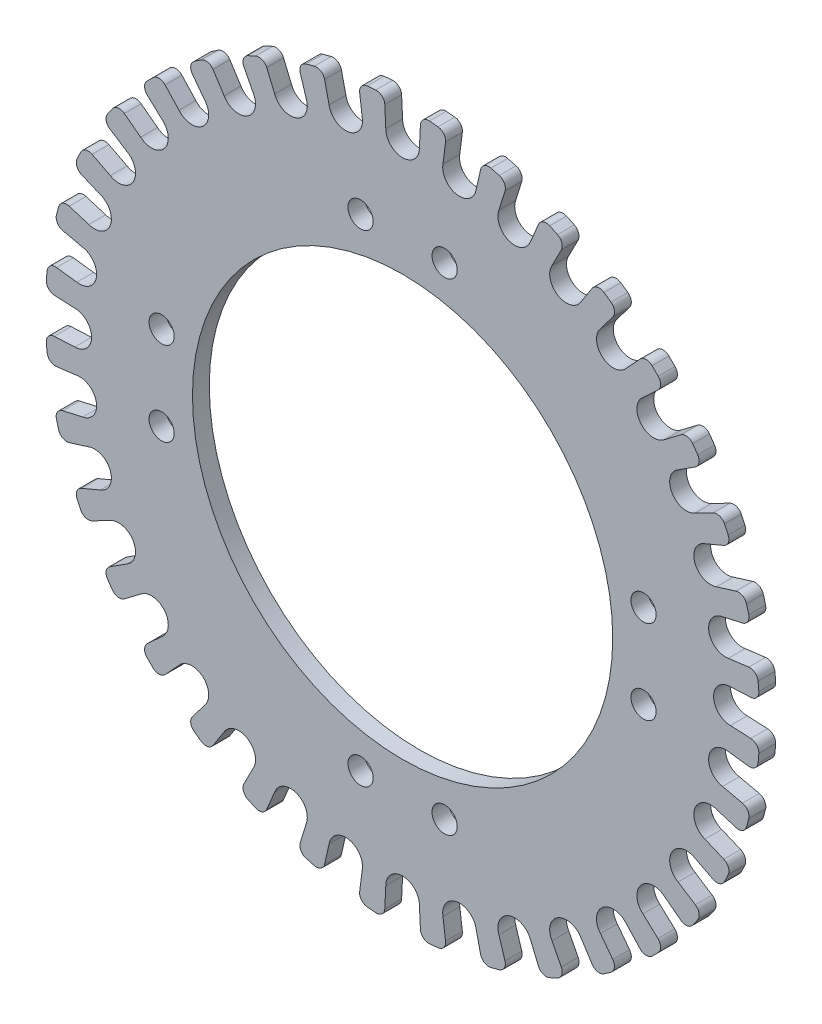
from build123d import *

# Parameters (mm, degrees)
SKETCH1_R                = 42.5
SKETCH1_R_2              = 25
SKETCH1_R_3              = 1.5
BOSS_EXTRUDE1_DEPTH      = 2
CUT_EXTRUDE1_DEPTH       = 61.137342808
FILLET1_R                = 1
CIRPATTERN1_COUNT        = 36
FILLET1_OF_CIRPATTERN1_R = 1


with BuildPart() as part:
    # Sketch1 → Boss-Extrude1 (new body)
    with BuildSketch(Plane.XY):
        Circle(SKETCH1_R)
        Circle(SKETCH1_R_2, mode=Mode.SUBTRACT)
        with Locations((-5, 28.665374196)):
            Circle(SKETCH1_R_3, mode=Mode.SUBTRACT)
        with Locations(Location((5, 28.665374196, 0), (0, 0, 180))):
            Circle(SKETCH1_R_3, mode=Mode.SUBTRACT)
        with Locations((28.665374196, 5)):
            Circle(SKETCH1_R_3, mode=Mode.SUBTRACT)
        with Locations(Location((28.665374196, -5, 0), (0, 0, 180))):
            Circle(SKETCH1_R_3, mode=Mode.SUBTRACT)
        with Locations((5, -28.665374196)):
            Circle(SKETCH1_R_3, mode=Mode.SUBTRACT)
        with Locations(Location((-5, -28.665374196, 0), (0, 0, 180))):
            Circle(SKETCH1_R_3, mode=Mode.SUBTRACT)
        with Locations((-28.665374196, -5)):
            Circle(SKETCH1_R_3, mode=Mode.SUBTRACT)
        with Locations(Location((-28.665374196, 5, 0), (0, 0, 180))):
            Circle(SKETCH1_R_3, mode=Mode.SUBTRACT)
    extrude(amount=BOSS_EXTRUDE1_DEPTH)

    # Sketch2 → Cut-Extrude1 (cut, through all)
    with BuildSketch(Plane.XY.offset(2)):
        with BuildLine():
            Line((-2, 39), (-2.25, 44.151660968))
            Line((-2.25, 44.151660968), (2.25, 44.151660968))
            Line((2.25, 44.151660968), (2, 39))
            ThreePointArc((2, 39), (0, 37), (-2, 39))
        make_face()
    cut_extrude1 = extrude(amount=-CUT_EXTRUDE1_DEPTH, mode=Mode.SUBTRACT)

    # Fillet1
    fillet1_edges = [part.edges().sort_by_distance(p)[0] for p in [
        (2.167165012, 42.444709868, 1),
        (-2.167165012, 42.444709868, 1),
    ]]
    fillet(fillet1_edges, radius=FILLET1_R)

    # CirPattern1: Cut-Extrude1 ×36 about axis
    cirpattern1_axis = Axis((0, 0, 0), (0, 0, 1))
    for i in range(1, CIRPATTERN1_COUNT):
        add(cut_extrude1.rotate(cirpattern1_axis, i * 360 / CIRPATTERN1_COUNT), mode=Mode.SUBTRACT)

    # Fillet1 of CirPattern1
    fillet1_of_cirpattern1_edges = [part.edges().sort_by_distance(p)[0] for p in [
        (-5.236205614, 42.176203608, 1),
        (-9.504687426, 41.423555098, 1),
        (-12.480476783, 40.626194743, 1),
        (-16.553414722, 39.143766567, 1),
        (-19.34553498, 37.841779508, 1),
        (-23.099174889, 35.674614496, 1),
        (-25.622788885, 33.907560952, 1),
        (-28.943078315, 31.121507317, 1),
        (-31.121507317, 28.943078315, 1),
        (-33.907560952, 25.622788885, 1),
        (-35.674614496, 23.099174889, 1),
        (-37.841779508, 19.34553498, 1),
        (-39.143766567, 16.553414722, 1),
        (-40.626194743, 12.480476783, 1),
        (-41.423555098, 9.504687426, 1),
        (-42.176203608, 5.236205614, 1),
        (-42.444709868, 2.167165012, 1),
        (-42.444709868, -2.167165012, 1),
        (-42.176203608, -5.236205614, 1),
        (-41.423555098, -9.504687426, 1),
        (-40.626194743, -12.480476783, 1),
        (-39.143766567, -16.553414722, 1),
        (-37.841779508, -19.34553498, 1),
        (-35.674614496, -23.099174889, 1),
        (-33.907560952, -25.622788885, 1),
        (-31.121507317, -28.943078315, 1),
        (-28.943078315, -31.121507317, 1),
        (-25.622788885, -33.907560952, 1),
        (-23.099174889, -35.674614496, 1),
        (-19.34553498, -37.841779508, 1),
        (-16.553414722, -39.143766567, 1),
        (-12.480476783, -40.626194743, 1),
        (-9.504687426, -41.423555098, 1),
        (-5.236205614, -42.176203608, 1),
        (-2.167165012, -42.444709868, 1),
        (2.167165012, -42.444709868, 1),
        (5.236205614, -42.176203608, 1),
        (9.504687426, -41.423555098, 1),
        (12.480476783, -40.626194743, 1),
        (16.553414722, -39.143766567, 1),
        (19.34553498, -37.841779508, 1),
        (23.099174889, -35.674614496, 1),
        (25.622788885, -33.907560952, 1),
        (28.943078315, -31.121507317, 1),
        (31.121507317, -28.943078315, 1),
        (33.907560952, -25.622788885, 1),
        (35.674614496, -23.099174889, 1),
        (37.841779508, -19.34553498, 1),
        (39.143766567, -16.553414722, 1),
        (40.626194743, -12.480476783, 1),
        (41.423555098, -9.504687426, 1),
        (42.176203608, -5.236205614, 1),
        (42.444709868, -2.167165012, 1),
        (42.444709868, 2.167165012, 1),
        (42.176203608, 5.236205614, 1),
        (41.423555098, 9.504687426, 1),
        (40.626194743, 12.480476783, 1),
        (39.143766567, 16.553414722, 1),
        (37.841779508, 19.34553498, 1),
        (35.674614496, 23.099174889, 1),
        (33.907560952, 25.622788885, 1),
        (31.121507317, 28.943078315, 1),
        (28.943078315, 31.121507317, 1),
        (25.622788885, 33.907560952, 1),
        (23.099174889, 35.674614496, 1),
        (19.34553498, 37.841779508, 1),
        (16.553414722, 39.143766567, 1),
        (12.480476783, 40.626194743, 1),
        (9.504687426, 41.423555098, 1),
        (5.236205614, 42.176203608, 1),
    ]]
    fillet(fillet1_of_cirpattern1_edges, radius=FILLET1_OF_CIRPATTERN1_R)


solid = part.part
